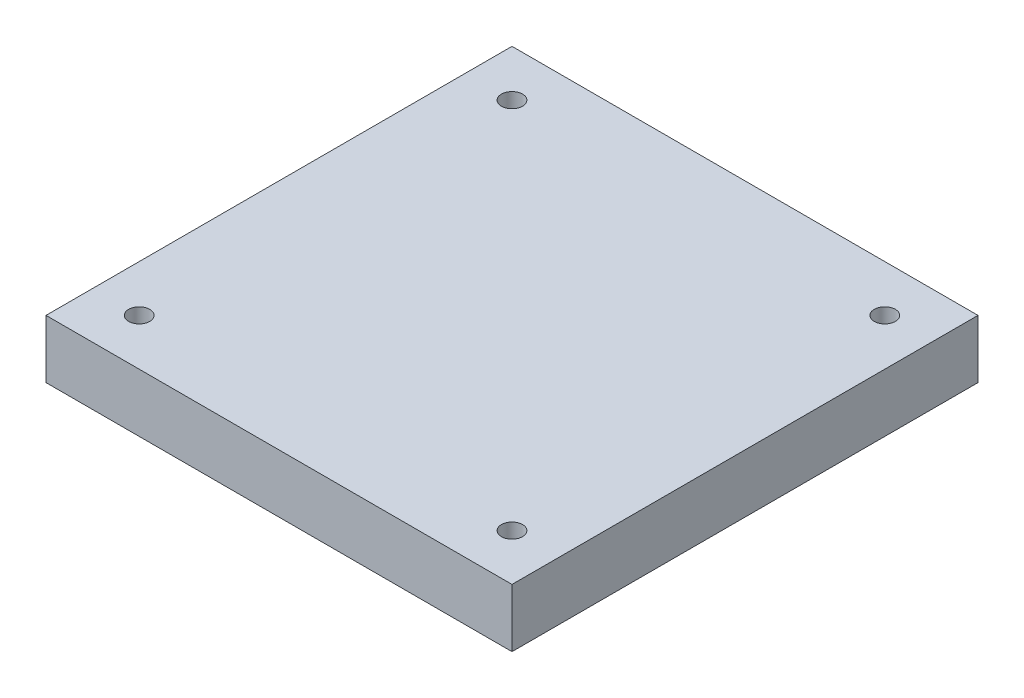
from build123d import *

# Parameters (mm, degrees)
SKETCH3_W                           = 101.6
SKETCH3_H                           = 12.7
BOSS_EXTRUDE1_DEPTH                 = 50.8
BASEBORDERRADIUSSKETCH_OUTSIDE_W    = 132.436
BASEBORDERRADIUSSKETCH_OUTSIDE_H    = 132.436
BASEBORDERRADIUSSKETCH_OUTSIDE_W_2  = 95.25
BASEBORDERRADIUSSKETCH_OUTSIDE_H_2  = 95.25
BASEBORDERRADIUSCUT_EXTRUDE_DEPTH   = 73.821966391
BUMPER_6_32_TAPPED_HOLE_D           = 4.3053
BUMPER_6_32_TAPPED_HOLE_CBORE_D     = 7.9375
BUMPER_6_32_TAPPED_HOLE_CBORE_DEPTH = 5.3848
BUMPERTHREADLPATTERN_COUNT          = 2
BUMPERTHREADLPATTERN_PITCH          = 76.2
BUMPERTHREADLPATTERN_COUNT_DIR2     = 2
BUMPERTHREADLPATTERN_PITCH_DIR2     = 76.2


with BuildPart() as part:
    # Sketch3 → Boss-Extrude1 (new, symmetric)
    with BuildSketch(Plane.XY):
        Rectangle(SKETCH3_W, SKETCH3_H)
    extrude(amount=BOSS_EXTRUDE1_DEPTH, both=True)

    # FacingTopSurfaceCut
    split(bisect_by=Plane(origin=(0, 5.953125, 0), x_dir=(1, 0, 0), z_dir=(0, 1, 0)), keep=Keep.BOTTOM)

    # FacingBottomSurfaceCut
    split(bisect_by=Plane(origin=(0, -5.953125, 0), x_dir=(-1, 0, 0), z_dir=(0, -1, 0)), keep=Keep.BOTTOM)

    # BaseBorderRadiusSketch outside → BaseBorderRadiusCut-Extrude (cut, through all)
    with BuildSketch(Plane(origin=(0, 5.953125, 0), x_dir=(1, 0, 0), z_dir=(0, 1, 0))):
        Rectangle(BASEBORDERRADIUSSKETCH_OUTSIDE_W, BASEBORDERRADIUSSKETCH_OUTSIDE_H)
        Rectangle(BASEBORDERRADIUSSKETCH_OUTSIDE_W_2, BASEBORDERRADIUSSKETCH_OUTSIDE_H_2, mode=Mode.SUBTRACT)
    extrude(amount=-BASEBORDERRADIUSCUT_EXTRUDE_DEPTH, mode=Mode.SUBTRACT)

    # Bumper#6-32 Tapped Hole (through all)
    with Locations(Plane(origin=(-38.1, -5.953125, 38.1), x_dir=(0, 0, -1), z_dir=(0, -1, 0))):
        with Locations((0, 0)):
            bumper_6_32_tapped_hole = CounterBoreHole(BUMPER_6_32_TAPPED_HOLE_D / 2, BUMPER_6_32_TAPPED_HOLE_CBORE_D / 2, BUMPER_6_32_TAPPED_HOLE_CBORE_DEPTH)

    # BumperThreadLPattern: Bumper_6-32 Tapped Hole 2 × 2
    with Locations(*[(j * BUMPERTHREADLPATTERN_PITCH_DIR2, 0, -i * BUMPERTHREADLPATTERN_PITCH) for i in range(BUMPERTHREADLPATTERN_COUNT) for j in range(BUMPERTHREADLPATTERN_COUNT_DIR2) if (i, j) != (0, 0)]):
        add(bumper_6_32_tapped_hole, mode=Mode.SUBTRACT)


solid = part.part
